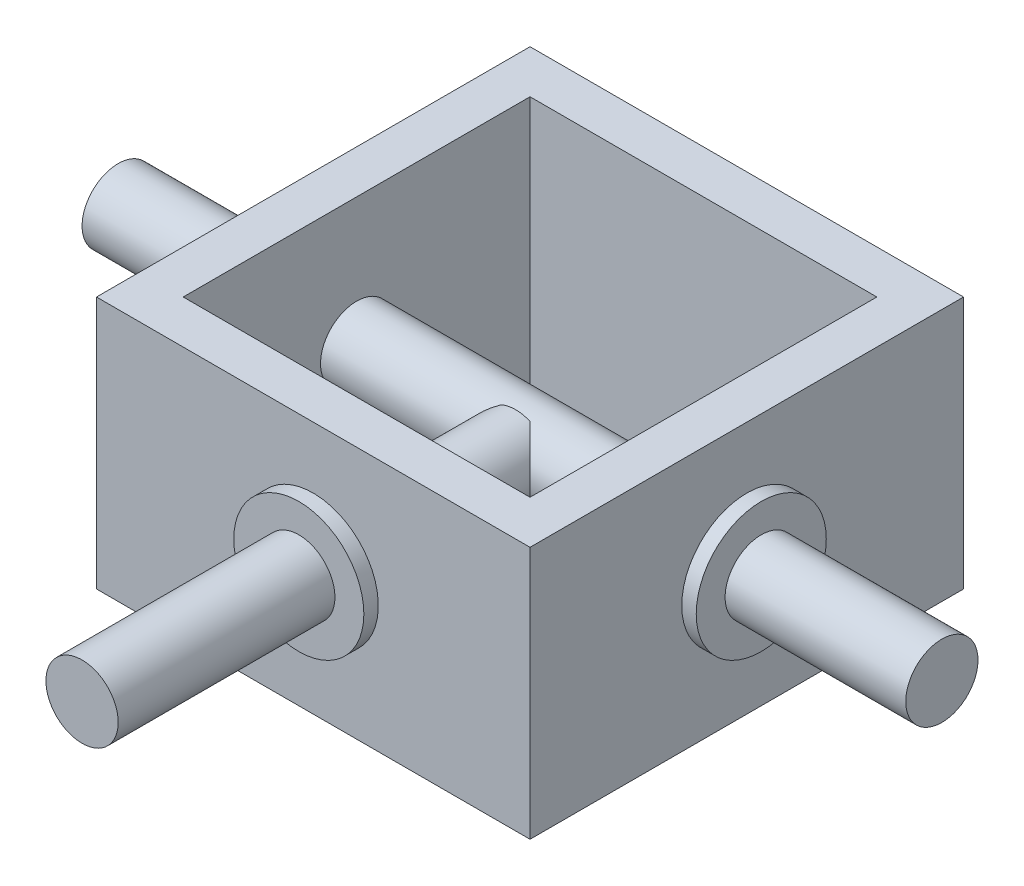
from build123d import *

# Parameters (mm, degrees)
SKETCH2_W                = 60
SKETCH2_H                = 60
SKETCH2_W_2              = 48
SKETCH2_H_2              = 48
BOSS_EXTRUDE1_DEPTH      = 35
SKETCH3_R                = 5
CUT_EXTRUDE1_DEPTH       = 76.663729752
CUT_EXTRUDE2_REACH       = 77.664
SKETCH4_R                = 5
BOSS_EXTRUDE2_START      = 2
SKETCH5_R                = 9
SKETCH5_R_2              = 5
BOSS_EXTRUDE2_DEPTH      = 2
BOSS_EXTRUDE3_START      = 2
SKETCH7_R                = 9
SKETCH7_R_2              = 5
BOSS_EXTRUDE3_DEPTH      = 2
BOSS_EXTRUDE4_DEPTH      = 57
BOSS_EXTRUDE4_DEPTH_BACK = 57
SKETCH8_R                = 5
BOSS_EXTRUDE5_DEPTH      = 30
BOSS_EXTRUDE5_DEPTH_BACK = 30
SKETCH9_R                = 5


with BuildPart() as part:
    # Sketch2 → Boss-Extrude1 (new body)
    with BuildSketch(Plane(origin=(0, 0, 0), x_dir=(1, 0, 0), z_dir=(0, 1, 0))):
        Rectangle(SKETCH2_W, SKETCH2_H)
        Rectangle(SKETCH2_W_2, SKETCH2_H_2, mode=Mode.SUBTRACT)
    extrude(amount=BOSS_EXTRUDE1_DEPTH)

    # Sketch3 → Cut-Extrude1 (cut, through all)
    with BuildSketch(Plane(origin=(30, 0, 0), x_dir=(0, 0, -1), z_dir=(1, 0, 0))):
        with Locations((0, 17.5)):
            Circle(SKETCH3_R)
    extrude(amount=-CUT_EXTRUDE1_DEPTH, mode=Mode.SUBTRACT)

    # Sketch4 → Cut-Extrude2 (cut, up to next)
    with BuildSketch(Plane.XY.offset(30), mode=Mode.PRIVATE) as cut_extrude2_sk1:
        with Locations((0, 17.5)):
            Circle(SKETCH4_R)
    cut_extrude2_tool1 = extrude(cut_extrude2_sk1.sketch, amount=-CUT_EXTRUDE2_REACH, mode=Mode.PRIVATE) & part.part
    add(cut_extrude2_tool1.solids().sort_by_distance((0, 17.5, 30))[0], mode=Mode.SUBTRACT)

    # Sketch5 → Boss-Extrude2 (add)
    with BuildSketch(Plane.XY.offset(30).offset(BOSS_EXTRUDE2_START)):
        with Locations(Location((0, 17.5, 0), (0, 0, 180))):
            Circle(SKETCH5_R)
        with Locations((0, 17.5)):
            Circle(SKETCH5_R_2, mode=Mode.SUBTRACT)
    extrude(amount=-BOSS_EXTRUDE2_DEPTH)

    # Sketch7 → Boss-Extrude3 (add)
    with BuildSketch(Plane(origin=(30, 0, 0), x_dir=(0, 0, -1), z_dir=(1, 0, 0)).offset(BOSS_EXTRUDE3_START)):
        with Locations(Location((0, 17.5, 0), (0, 0, 180))):
            Circle(SKETCH7_R)
        with Locations((0, 17.5)):
            Circle(SKETCH7_R_2, mode=Mode.SUBTRACT)
    boss_extrude3 = extrude(amount=-BOSS_EXTRUDE3_DEPTH)

    # Mirror1: Boss-Extrude3 across plane
    add(boss_extrude3.mirror(Plane(origin=(0, 0, 0), x_dir=(0, 0, 1), z_dir=(1, 0, 0))))

    # Sketch8 → Boss-Extrude4 (add, two sides: drawn at the far end of the back side and taken through both)
    with BuildSketch(Plane(origin=(0, 0, 0), x_dir=(0, 0, -1), z_dir=(1, 0, 0)).offset(-BOSS_EXTRUDE4_DEPTH_BACK)):
        with Locations((0, 17.5)):
            Circle(SKETCH8_R)
    extrude(amount=BOSS_EXTRUDE4_DEPTH + BOSS_EXTRUDE4_DEPTH_BACK)

    # Sketch9 → Boss-Extrude5 (add, two sides: drawn at the far end of the back side and taken through both)
    with BuildSketch(Plane.XY.offset(32).offset(-BOSS_EXTRUDE5_DEPTH_BACK)):
        with Locations(Location((0, 17.5, 0), (0, 0, 293.578178478))):
            Circle(SKETCH9_R)
    extrude(amount=BOSS_EXTRUDE5_DEPTH + BOSS_EXTRUDE5_DEPTH_BACK)


solid = part.part
